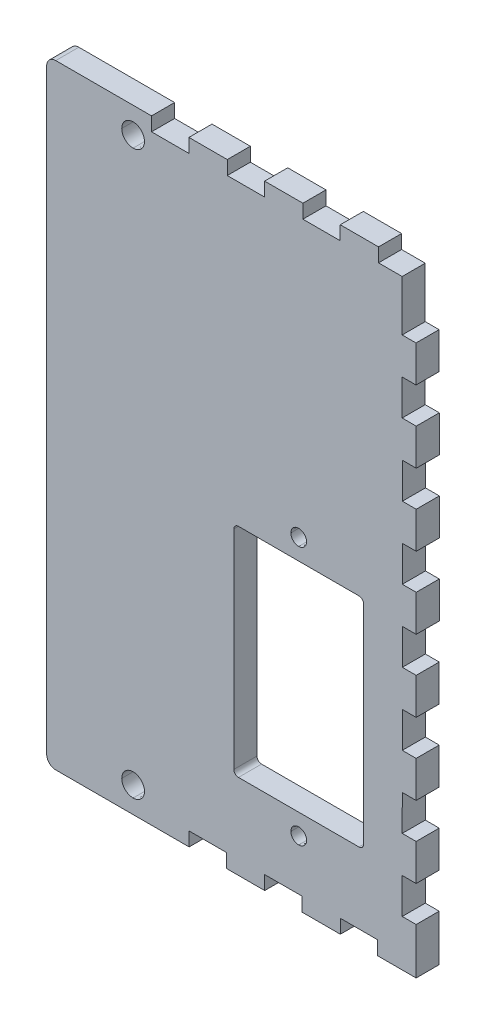
from build123d import *

# Parameters (mm, degrees)
BOSS_EXTRUDE1_DEPTH = 5


with BuildPart() as part:
    # Sketch1 → Boss-Extrude1 (new body)
    with BuildSketch(Plane.XY):
        with BuildLine():
            Line((122.019699995, 170.510603399), (125.035491487, 170.510603399))
            Line((125.035491487, 170.510603399), (125.035491487, 160.474074598))
            Line((125.035491487, 160.474074598), (116.710185498, 160.474074598))
            Line((116.710185498, 160.474074598), (116.710185498, 163.474068598))
            Line((116.710185498, 163.474068598), (108.619297498, 163.474068598))
            Line((108.619297498, 163.474068598), (108.619297498, 160.474074598))
            Line((108.619297498, 160.474074598), (100.328384498, 160.474074598))
            Line((100.328384498, 160.474074598), (100.328384498, 163.474068598))
            Line((100.328384498, 163.474068598), (92.237463498, 163.474068598))
            Line((92.237463498, 163.474068598), (92.237463498, 160.474074598))
            Line((92.237463498, 160.474074598), (83.946550498, 160.474074598))
            Line((83.946550498, 160.474074598), (83.946550498, 163.474068598))
            Line((83.946550498, 163.474068598), (75.868574498, 163.474068598))
            Line((75.868574498, 163.474068598), (75.868574498, 160.474804118))
            Line((75.868574498, 160.474804118), (46.973908888, 160.474804118))
            ThreePointArc((46.973908888, 160.474804118), (45.585129957, 161.050055187), (45.009878888, 162.438834118))
            Line((45.009878888, 162.438834118), (45.009878888, 291.583555118))
            ThreePointArc((45.009878888, 291.583555118), (45.585129957, 292.972334049), (46.973908888, 293.547585118))
            Line((46.973908888, 293.547585118), (67.718123868, 293.547585118))
            Line((67.718123868, 293.547585118), (67.71835615, 290.555211127))
            Line((67.71835615, 290.555211127), (75.820281125, 290.555840035))
            Line((75.820281125, 290.555840035), (75.82004825, 293.555862026))
            Line((75.82004825, 293.555862026), (84.126345225, 293.556506799))
            Line((84.126345225, 293.556506799), (84.1265781, 290.556484808))
            Line((84.1265781, 290.556484808), (92.217503076, 290.557112862))
            Line((92.217503076, 290.557112862), (92.217270201, 293.557134853))
            Line((92.217270201, 293.557134853), (100.508146176, 293.557778429))
            Line((100.508146176, 293.557778429), (100.508379051, 290.557756438))
            Line((100.508379051, 290.557756438), (108.599303027, 290.558384492))
            Line((108.599303027, 290.558384492), (108.599070151, 293.558406483))
            Line((108.599070151, 293.558406483), (116.889983151, 293.558406483))
            Line((116.889983151, 293.558406483), (116.889983151, 290.558384483))
            Line((116.889983151, 290.558384483), (122.009855888, 290.558384483))
            Line((122.009855888, 290.558384483), (122.009855888, 279.590084215))
            Line((122.009855888, 279.590084215), (125.009878888, 279.590084215))
            Line((125.009878888, 279.590084215), (125.009878888, 271.704151215))
            Line((125.009878888, 271.704151215), (122.007220126, 271.704151215))
            Line((122.007220126, 271.704151215), (122.007220126, 264.011738232))
            Line((122.007220126, 264.011738232), (125.059148145, 264.013282494))
            Line((125.059148145, 264.013282494), (125.059148145, 256.117565387))
            Line((125.059148145, 256.117565387), (122.063013449, 256.119081417))
            Line((122.063013449, 256.119081417), (122.059121879, 248.428160402))
            Line((122.059121879, 248.428160402), (125.059148145, 248.426642402))
            Line((125.059148145, 248.426642402), (125.055151734, 240.528524414))
            Line((125.055151734, 240.528524414), (122.055129118, 240.530042412))
            Line((122.055129118, 240.530042412), (122.051237547, 232.839120396))
            Line((122.051237547, 232.839120396), (125.051260163, 232.837602399))
            Line((125.051260163, 232.837602399), (125.047267389, 224.946670409))
            Line((125.047267389, 224.946670409), (122.047244773, 224.948188407))
            Line((122.047244773, 224.948188407), (122.043353202, 217.257267391))
            Line((122.043353202, 217.257267391), (125.043375818, 217.255749394))
            Line((125.043375818, 217.255749394), (125.039383043, 209.364816404))
            Line((125.039383043, 209.364816404), (122.039360427, 209.366334401))
            Line((122.039360427, 209.366334401), (122.035468871, 201.675441386))
            Line((122.035468871, 201.675441386), (125.035491487, 201.673923388))
            Line((125.035491487, 201.673923388), (125.035491487, 193.78332734))
            Line((125.035491487, 193.78332734), (122.031476282, 193.784876396))
            Line((122.031476282, 193.784876396), (122.027584712, 186.09395438))
            Line((122.027584712, 186.09395438), (125.035491487, 186.092432394))
            Line((125.035491487, 186.092432394), (125.035491487, 178.201498384))
            Line((125.035491487, 178.201498384), (122.019699995, 178.20302436))
            Line((122.019699995, 178.20302436), (122.019699995, 170.510603399))
        make_face()
        with BuildLine():
            Line((86.552275995, 178.864581399), (112.650775995, 178.864581399))
            add(Edge.make_bspline(
                [(112.650775995, 178.864581399), (113.204636995, 178.864581399), (113.652664995, 179.312256399), (113.652664995, 179.864354399)],
                knots=[0, 0, 0, 0, 1, 1, 1, 1], degree=3))
            Line((113.652664995, 179.864354399), (113.652664995, 224.964558399))
            add(Edge.make_bspline(
                [(113.652664995, 224.964558399), (113.652664995, 225.516656399), (113.204636995, 225.964331399), (112.650775995, 225.964331399)],
                knots=[0, 0, 0, 0, 1, 1, 1, 1], degree=3))
            Line((112.650775995, 225.964331399), (86.552275995, 225.964331399))
            add(Edge.make_bspline(
                [(86.552275995, 225.964331399), (85.998414995, 225.964331399), (85.550386995, 225.516656399), (85.550386995, 224.964558399)],
                knots=[0, 0, 0, 0, 1, 1, 1, 1], degree=3))
            Line((85.550386995, 224.964558399), (85.550386995, 179.864354399))
            add(Edge.make_bspline(
                [(85.550386995, 179.864354399), (85.550386995, 179.312256399), (85.998414995, 178.864581399), (86.552275995, 178.864581399)],
                knots=[0, 0, 0, 0, 1, 1, 1, 1], degree=3))
        make_face(mode=Mode.SUBTRACT)
        with BuildLine():
            add(Edge.make_bspline(
                [(97.901136995, 230.414622399), (97.901136995, 229.475528399), (98.663136995, 228.714233399), (99.601525995, 228.714233399)],
                knots=[0, 0, 0, 0, 1, 1, 1, 1], degree=3))
            add(Edge.make_bspline(
                [(99.601525995, 228.714233399), (100.539914995, 228.714233399), (101.301914995, 229.475528399), (101.301914995, 230.414622399)],
                knots=[0, 0, 0, 0, 1, 1, 1, 1], degree=3))
            add(Edge.make_bspline(
                [(101.301914995, 230.414622399), (101.301914995, 231.353364399), (100.539914995, 232.114658399), (99.601525995, 232.114658399)],
                knots=[0, 0, 0, 0, 1, 1, 1, 1], degree=3))
            add(Edge.make_bspline(
                [(99.601525995, 232.114658399), (98.663136995, 232.114658399), (97.901136995, 231.353364399), (97.901136995, 230.414622399)],
                knots=[0, 0, 0, 0, 1, 1, 1, 1], degree=3))
        make_face(mode=Mode.SUBTRACT)
        with BuildLine():
            add(Edge.make_bspline(
                [(97.901136995, 174.414290399), (97.901136995, 173.475548399), (98.663136995, 172.714254399), (99.601525995, 172.714254399)],
                knots=[0, 0, 0, 0, 1, 1, 1, 1], degree=3))
            add(Edge.make_bspline(
                [(99.601525995, 172.714254399), (100.539914995, 172.714254399), (101.301914995, 173.475548399), (101.301914995, 174.414290399)],
                knots=[0, 0, 0, 0, 1, 1, 1, 1], degree=3))
            add(Edge.make_bspline(
                [(101.301914995, 174.414290399), (101.301914995, 175.353384399), (100.539914995, 176.114679399), (99.601525995, 176.114679399)],
                knots=[0, 0, 0, 0, 1, 1, 1, 1], degree=3))
            add(Edge.make_bspline(
                [(99.601525995, 176.114679399), (98.663136995, 176.114679399), (97.901136995, 175.353384399), (97.901136995, 174.414290399)],
                knots=[0, 0, 0, 0, 1, 1, 1, 1], degree=3))
        make_face(mode=Mode.SUBTRACT)
        with BuildLine():
            add(Edge.make_bspline(
                [(61.267952995, 166.050110399), (61.267952995, 164.689432399), (62.371907995, 163.586384399), (63.731417995, 163.586384399)],
                knots=[0, 0, 0, 0, 1, 1, 1, 1], degree=3))
            add(Edge.make_bspline(
                [(63.731417995, 163.586384399), (65.090924995, 163.586384399), (66.194885995, 164.689432399), (66.194885995, 166.050110399)],
                knots=[0, 0, 0, 0, 1, 1, 1, 1], degree=3))
            add(Edge.make_bspline(
                [(66.194885995, 166.050110399), (66.194885995, 167.410262399), (65.090924995, 168.513317399), (63.731417995, 168.513317399)],
                knots=[0, 0, 0, 0, 1, 1, 1, 1], degree=3))
            add(Edge.make_bspline(
                [(63.731417995, 168.513317399), (62.371907995, 168.513317399), (61.267952995, 167.410262399), (61.267952995, 166.050110399)],
                knots=[0, 0, 0, 0, 1, 1, 1, 1], degree=3))
        make_face(mode=Mode.SUBTRACT)
        with BuildLine():
            add(Edge.make_bspline(
                [(61.267952995, 287.970112399), (61.267952995, 286.609434399), (62.371907995, 285.506386399), (63.731417995, 285.506386399)],
                knots=[0, 0, 0, 0, 1, 1, 1, 1], degree=3))
            add(Edge.make_bspline(
                [(63.731417995, 285.506386399), (65.090924995, 285.506386399), (66.194885995, 286.609434399), (66.194885995, 287.970112399)],
                knots=[0, 0, 0, 0, 1, 1, 1, 1], degree=3))
            add(Edge.make_bspline(
                [(66.194885995, 287.970112399), (66.194885995, 289.330264399), (65.090924995, 290.433319399), (63.731417995, 290.433319399)],
                knots=[0, 0, 0, 0, 1, 1, 1, 1], degree=3))
            add(Edge.make_bspline(
                [(63.731417995, 290.433319399), (62.371907995, 290.433319399), (61.267952995, 289.330264399), (61.267952995, 287.970112399)],
                knots=[0, 0, 0, 0, 1, 1, 1, 1], degree=3))
        make_face(mode=Mode.SUBTRACT)
    extrude(amount=BOSS_EXTRUDE1_DEPTH)


solid = part.part
